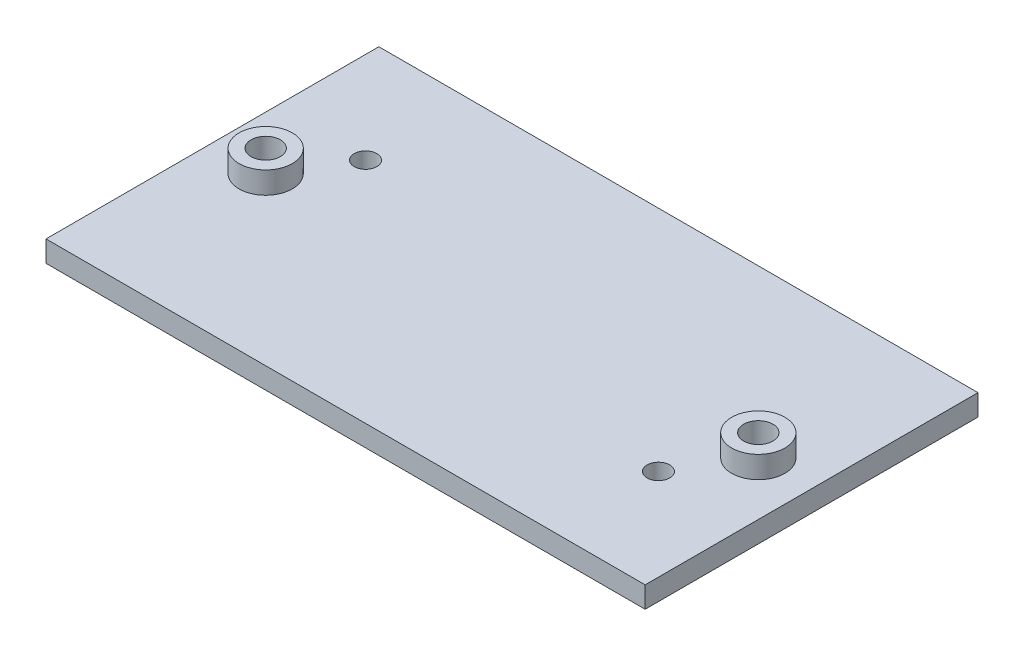
from build123d import *

# Parameters (mm, degrees)
PLATE_START      = 92.57
PLATE_SKETCH_W   = 90
PLATE_SKETCH_H   = 50
PLATE_SKETCH_R   = 2.2
PLATE_SKETCH_R_2 = 1.7
PLATE_DEPTH      = 3.18
PADS_START       = 95.75
PADS_SKETCH_R    = 4
PADS_SKETCH_R_2  = 2.2
PADS_DEPTH       = 3.3


with BuildPart() as part:
    # Plate Sketch → Plate (new body)
    with BuildSketch(Plane(origin=(0, 0, 0), x_dir=(1, 0, 0), z_dir=(0, 1, 0)).offset(PLATE_START)):
        Rectangle(PLATE_SKETCH_W, PLATE_SKETCH_H)
        with Locations((-37, 0)):
            Circle(PLATE_SKETCH_R, mode=Mode.SUBTRACT)
        with Locations((37, 0)):
            Circle(PLATE_SKETCH_R, mode=Mode.SUBTRACT)
        with Locations((-31.25, 9.25)):
            Circle(PLATE_SKETCH_R_2, mode=Mode.SUBTRACT)
        with Locations((31.25, -9.25)):
            Circle(PLATE_SKETCH_R_2, mode=Mode.SUBTRACT)
    extrude(amount=PLATE_DEPTH)

    # Pads Sketch → Pads (add)
    # profile 1 of 2: a face of its own
    with BuildSketch(Plane(origin=(0, 0, 0), x_dir=(1, 0, 0), z_dir=(0, 1, 0)).offset(PADS_START)):
        with Locations((-37, 0)):
            Circle(PADS_SKETCH_R)
        with Locations((-37, 0)):
            Circle(PADS_SKETCH_R_2, mode=Mode.SUBTRACT)
    # profile 2 of 2: a face of its own
    with BuildSketch(Plane(origin=(0, 0, 0), x_dir=(1, 0, 0), z_dir=(0, 1, 0)).offset(PADS_START)):
        with Locations((37, 0)):
            Circle(PADS_SKETCH_R)
        with Locations((37, 0)):
            Circle(PADS_SKETCH_R_2, mode=Mode.SUBTRACT)
    extrude(amount=PADS_DEPTH)


solid = part.part
